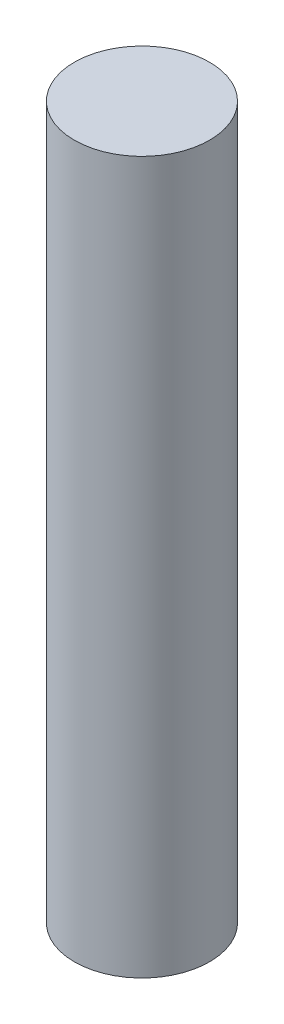
from build123d import *

# Parameters (mm, degrees)
SKETCH2_R           = 1.9
BOSS_EXTRUDE1_DEPTH = 20


with BuildPart() as part:
    # Sketch2 → Boss-Extrude1 (new body)
    with BuildSketch(Plane(origin=(0, 0, 0), x_dir=(1, 0, 0), z_dir=(0, 1, 0))):
        with Locations(Location((0, 0, 0), (0, 0, 270))):
            Circle(SKETCH2_R)
    extrude(amount=BOSS_EXTRUDE1_DEPTH)


solid = part.part
